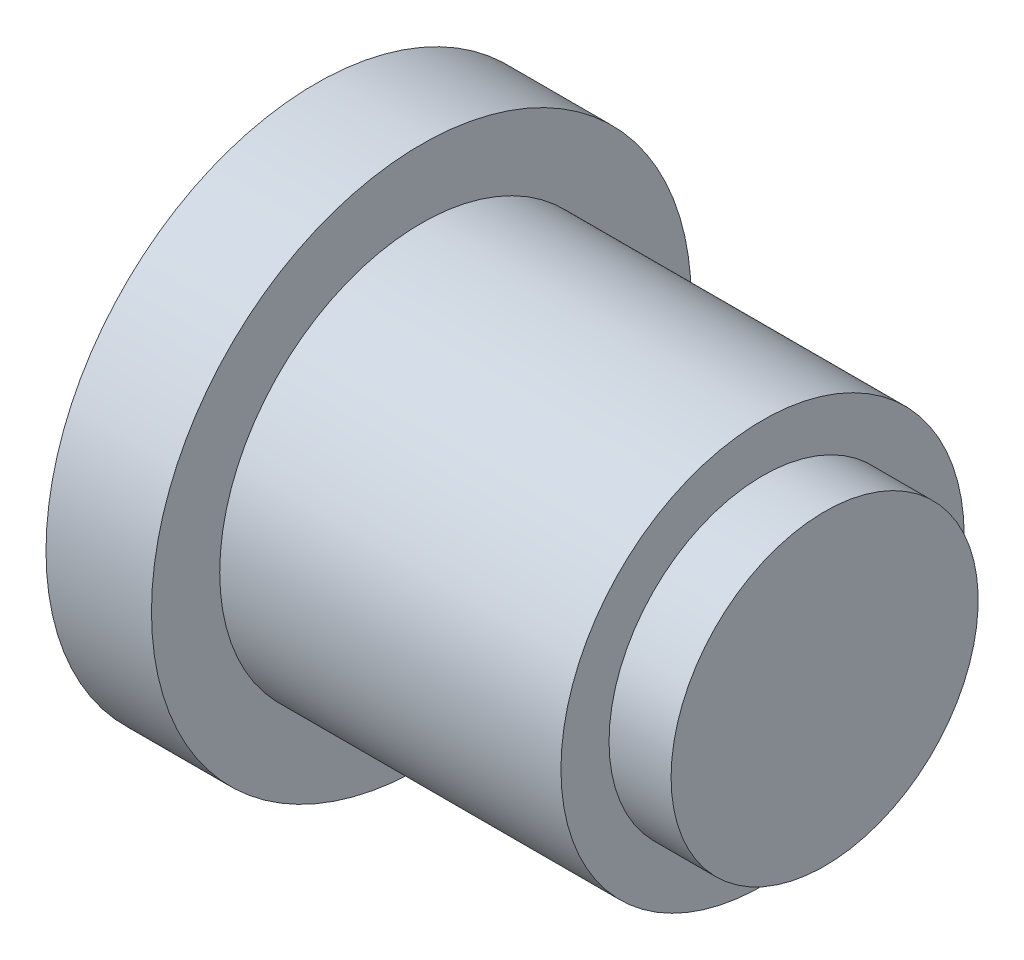
from build123d import *


with BuildPart() as part:
    # ｽｹｯﾁ1 → 回転1 (revolve)
    with BuildSketch(Plane.XY, mode=Mode.PRIVATE) as revolve_1_sk:
        Polygon((0, 0), (0, 87), (34, 87), (34, 65), (144, 65), (144, 49.5), (164, 49.5), (164, 0), align=None)
    revolve(revolve_1_sk.sketch.rotate(Axis((0, 0, 0), (1, 0, 0)), 90), axis=Axis((0, 0, 0), (1, 0, 0)))


solid = part.part
